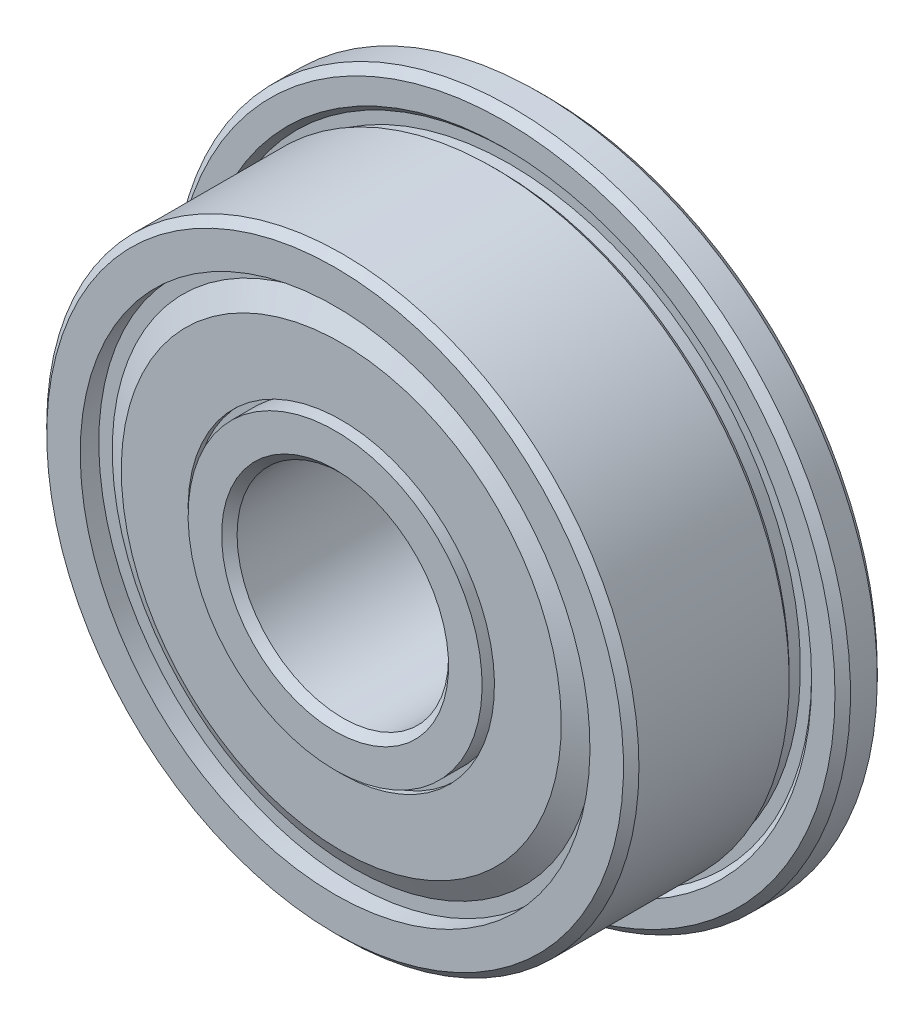
from build123d import *

# Parameters (mm, degrees)
FILLET1_SIZE      = 0.1828125
FILLET2_SIZE      = 0.1828125
CIRPATTERN3_COUNT = 8
SKETCH8_W         = 0.585
SKETCH8_H         = 0.4875


with BuildPart() as part:
    # Sketch2 → Revolve1 (revolve)
    with BuildSketch(Plane(origin=(0, 0, 0), x_dir=(0, 0, -1), z_dir=(1, 0, 0)), mode=Mode.PRIVATE) as revolve1_sk:
        with BuildLine():
            Line((2.5, 8), (1.5, 8))
            Line((1.5, 8), (1.5, 7.265165043))
            Line((1.5, 7.265165043), (1.632582521, 7.132582521))
            Line((1.632582521, 7.132582521), (1.632582521, 6.867417479))
            Line((1.632582521, 6.867417479), (1.367417479, 6.867417479))
            Line((1.367417479, 6.867417479), (1.234834957, 7))
            Line((1.234834957, 7), (-2.5, 7))
            Line((-2.5, 7), (-2.5, 5.5375))
            Line((-2.5, 5.5375), (-0.892823611, 5.5375))
            ThreePointArc((-0.892823611, 5.5375), (0, 5.9405), (0.892823611, 5.5375))
            Line((0.892823611, 5.5375), (2.5, 5.5375))
            Line((2.5, 5.5375), (2.5, 8))
        make_face()
        with BuildLine():
            Line((2.5, 2.5), (-2.5, 2.5))
            Line((-2.5, 2.5), (-2.5, 3.9625))
            Line((-2.5, 3.9625), (-0.892823611, 3.9625))
            ThreePointArc((-0.892823611, 3.9625), (0, 3.5595), (0.892823611, 3.9625))
            Line((0.892823611, 3.9625), (2.5, 3.9625))
            Line((2.5, 3.9625), (2.5, 2.5))
        make_face()
    revolve(revolve1_sk.sketch.rotate(Axis((0, 0, 0), (0, 0, -1)), 180), axis=Axis((0, 0, 0), (0, 0, -1)))

    # Fillet1
    fillet1_edges = [part.edges().sort_by_distance(p)[0] for p in [
        (0, 7, 2.5),
        (0, 8, -2.5),
        (0, 8, -1.5),
    ]]
    chamfer(fillet1_edges, length=FILLET1_SIZE)

    # Fillet2
    fillet2_edges = [part.edges().sort_by_distance(p)[0] for p in [
        (0, 2.5, -2.5),
        (0, 2.5, 2.5),
    ]]
    chamfer(fillet2_edges, length=FILLET2_SIZE)

    # Sketch8 → Cut-Revolve1 (revolve, cut)
    with BuildSketch(Plane(origin=(0, 0, 0), x_dir=(0, 0, -1), z_dir=(1, 0, 0)), mode=Mode.PRIVATE) as cut_revolve1_sk:
        with Locations((-2.2075, 5.78125)):
            Rectangle(SKETCH8_W, SKETCH8_H)
        with Locations((2.2075, 5.78125)):
            Rectangle(SKETCH8_W, SKETCH8_H)
        with Locations((2.2075, 3.71875)):
            Rectangle(SKETCH8_W, SKETCH8_H)
        with Locations((-2.2075, 3.71875)):
            Rectangle(SKETCH8_W, SKETCH8_H)
    revolve(cut_revolve1_sk.sketch.rotate(Axis((0, 0, 0), (0, 0, -1)), 180), axis=Axis((0, 0, 0), (0, 0, -1)), mode=Mode.SUBTRACT)


with BuildPart() as body_2:
    # Sketch7 → Revolve3 (revolve)
    with BuildSketch(Plane.XY):
        with BuildLine():
            Line((0, 5.9405), (0, 3.5595))
            ThreePointArc((0, 3.5595), (-1.1905, 4.75), (0, 5.9405))
        make_face()
    revolve(axis=Axis((0, 5.9405, 0), (0, -1, 0)))


with BuildPart() as cirpattern3_1:
    # CirPattern3: pattern copy
    add(body_2.part.rotate(Axis((0, 0, 0), (0, 0, 1)), 1 * 360 / CIRPATTERN3_COUNT))


with BuildPart() as cirpattern3_2:
    # CirPattern3: pattern copy
    add(body_2.part.rotate(Axis((0, 0, 0), (0, 0, 1)), 2 * 360 / CIRPATTERN3_COUNT))


with BuildPart() as cirpattern3_3:
    # CirPattern3: pattern copy
    add(body_2.part.rotate(Axis((0, 0, 0), (0, 0, 1)), 3 * 360 / CIRPATTERN3_COUNT))


with BuildPart() as cirpattern3_4:
    # CirPattern3: pattern copy
    add(body_2.part.rotate(Axis((0, 0, 0), (0, 0, 1)), 4 * 360 / CIRPATTERN3_COUNT))


with BuildPart() as cirpattern3_5:
    # CirPattern3: pattern copy
    add(body_2.part.rotate(Axis((0, 0, 0), (0, 0, 1)), 5 * 360 / CIRPATTERN3_COUNT))


with BuildPart() as cirpattern3_6:
    # CirPattern3: pattern copy
    add(body_2.part.rotate(Axis((0, 0, 0), (0, 0, 1)), 6 * 360 / CIRPATTERN3_COUNT))


with BuildPart() as cirpattern3_7:
    # CirPattern3: pattern copy
    add(body_2.part.rotate(Axis((0, 0, 0), (0, 0, 1)), 7 * 360 / CIRPATTERN3_COUNT))


with BuildPart() as body_10:
    # Sketch9 → Revolve4 (revolve)
    with BuildSketch(Plane(origin=(0, 0, 0), x_dir=(0, 0, -1), z_dir=(1, 0, 0)), mode=Mode.PRIVATE) as revolve4_sk:
        Polygon((-1.915, 6.025), (-1.915, 5.667857143), (-2.2075, 5.161232282), (-2.2075, 3.62125), (-2.35375, 3.62125), (-2.35375, 5.200419851), (-2.06125, 5.707044712), (-2.06125, 6.025), align=None)
        Polygon((1.915, 6.025), (1.915, 5.667857143), (2.2075, 5.161232282), (2.2075, 3.62125), (2.35375, 3.62125), (2.35375, 5.200419851), (2.06125, 5.707044712), (2.06125, 6.025), align=None)
    revolve(revolve4_sk.sketch.rotate(Axis((0, 0, 0), (0, 0, -1)), 180), axis=Axis((0, 0, 0), (0, 0, -1)))


solid = Compound([part.part, body_2.part, cirpattern3_1.part, cirpattern3_2.part, cirpattern3_3.part, cirpattern3_4.part, cirpattern3_5.part, cirpattern3_6.part, cirpattern3_7.part, body_10.part])
